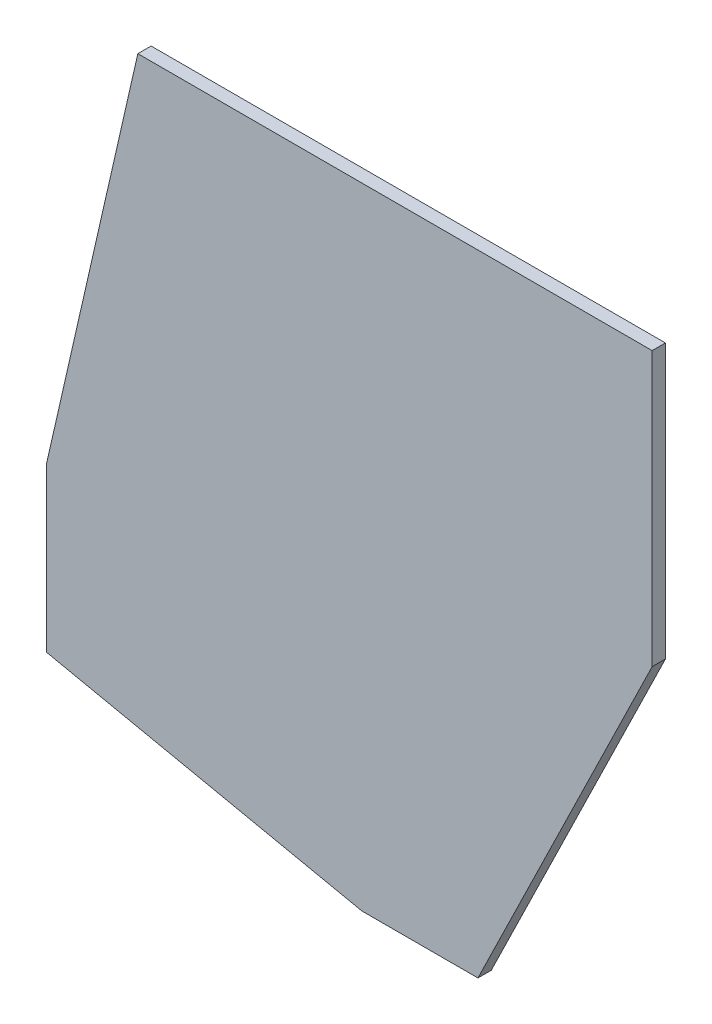
from build123d import *

# Parameters (mm, degrees)
SKETCH_1_R         = 13
EXTRUDE_1545_DEPTH = 16
EXTRUDE_1_DEPTH    = 16


with BuildPart() as part:
    # 草图1 → Extrude 1545 (new body)
    with BuildSketch(Plane.XY):
        Polygon((730, -330), (520, -760), (380, -760), (0, -680), (0, -482.786642105), (110, 0), (730, 0), align=None)
        with Locations((510, -70)):
            Circle(SKETCH_1_R, mode=Mode.SUBTRACT)
        with Locations((590, -70)):
            Circle(SKETCH_1_R, mode=Mode.SUBTRACT)
        with Locations((670, -70)):
            Circle(SKETCH_1_R, mode=Mode.SUBTRACT)
        with Locations((510, -150)):
            Circle(SKETCH_1_R, mode=Mode.SUBTRACT)
        with Locations((590, -150)):
            Circle(SKETCH_1_R, mode=Mode.SUBTRACT)
        with Locations((670, -150)):
            Circle(SKETCH_1_R, mode=Mode.SUBTRACT)
        with Locations((510, -230)):
            Circle(SKETCH_1_R, mode=Mode.SUBTRACT)
        with Locations((590, -230)):
            Circle(SKETCH_1_R, mode=Mode.SUBTRACT)
        with Locations((670, -230)):
            Circle(SKETCH_1_R, mode=Mode.SUBTRACT)
        with Locations(Location((230, -230, 0), (0, 0, 180))):
            Circle(SKETCH_1_R, mode=Mode.SUBTRACT)
        with Locations(Location((310, -230, 0), (0, 0, 180))):
            Circle(SKETCH_1_R, mode=Mode.SUBTRACT)
        with Locations(Location((390, -230, 0), (0, 0, 180))):
            Circle(SKETCH_1_R, mode=Mode.SUBTRACT)
        with Locations(Location((230, -150, 0), (0, 0, 180))):
            Circle(SKETCH_1_R, mode=Mode.SUBTRACT)
        with Locations(Location((310, -150, 0), (0, 0, 180))):
            Circle(SKETCH_1_R, mode=Mode.SUBTRACT)
        with Locations(Location((390, -150, 0), (0, 0, 180))):
            Circle(SKETCH_1_R, mode=Mode.SUBTRACT)
        with Locations(Location((230, -70, 0), (0, 0, 180))):
            Circle(SKETCH_1_R, mode=Mode.SUBTRACT)
        with Locations(Location((310, -70, 0), (0, 0, 180))):
            Circle(SKETCH_1_R, mode=Mode.SUBTRACT)
        with Locations(Location((390, -70, 0), (0, 0, 180))):
            Circle(SKETCH_1_R, mode=Mode.SUBTRACT)
        with Locations((150, -70)):
            Circle(SKETCH_1_R, mode=Mode.SUBTRACT)
        with Locations((150, -150)):
            Circle(SKETCH_1_R, mode=Mode.SUBTRACT)
        with Locations((150, -230)):
            Circle(SKETCH_1_R, mode=Mode.SUBTRACT)
        with Locations((590, -370)):
            Circle(SKETCH_1_R, mode=Mode.SUBTRACT)
        with Locations((510, -370)):
            Circle(SKETCH_1_R, mode=Mode.SUBTRACT)
        with Locations(Location((390, -370, 0), (0, 0, 180))):
            Circle(SKETCH_1_R, mode=Mode.SUBTRACT)
        with Locations(Location((310, -370, 0), (0, 0, 180))):
            Circle(SKETCH_1_R, mode=Mode.SUBTRACT)
        with Locations((506, -470)):
            Circle(SKETCH_1_R, mode=Mode.SUBTRACT)
        with Locations((506, -550)):
            Circle(SKETCH_1_R, mode=Mode.SUBTRACT)
        with Locations((506, -630)):
            Circle(SKETCH_1_R, mode=Mode.SUBTRACT)
        with Locations((506, -710)):
            Circle(SKETCH_1_R, mode=Mode.SUBTRACT)
        with Locations(Location((394, -710, 0), (0, 0, 180))):
            Circle(SKETCH_1_R, mode=Mode.SUBTRACT)
        with Locations(Location((394, -630, 0), (0, 0, 180))):
            Circle(SKETCH_1_R, mode=Mode.SUBTRACT)
        with Locations(Location((394, -550, 0), (0, 0, 180))):
            Circle(SKETCH_1_R, mode=Mode.SUBTRACT)
        with Locations(Location((394, -470, 0), (0, 0, 180))):
            Circle(SKETCH_1_R, mode=Mode.SUBTRACT)
        with Locations((149.479377198, -397.484050539)):
            Circle(SKETCH_1_R, mode=Mode.SUBTRACT)
        with Locations((99.493096694, -459.945012437)):
            Circle(SKETCH_1_R, mode=Mode.SUBTRACT)
        with Locations((49.506816189, -522.405974336)):
            Circle(SKETCH_1_R, mode=Mode.SUBTRACT)
        with Locations((61.981497584, -634.85321674)):
            Circle(SKETCH_1_R, mode=Mode.SUBTRACT)
        with Locations((111.967778088, -572.392254841)):
            Circle(SKETCH_1_R, mode=Mode.SUBTRACT)
        with Locations((161.954058593, -509.931292942)):
            Circle(SKETCH_1_R, mode=Mode.SUBTRACT)
        with Locations((211.940339097, -447.470331043)):
            Circle(SKETCH_1_R, mode=Mode.SUBTRACT)
        with Locations(Location((174.428739987, -622.378535345, 0), (0, 0, 180))):
            Circle(SKETCH_1_R, mode=Mode.SUBTRACT)
        with Locations(Location((224.415020492, -559.917573446, 0), (0, 0, 180))):
            Circle(SKETCH_1_R, mode=Mode.SUBTRACT)
        with Locations(Location((274.401300996, -497.456611548, 0), (0, 0, 180))):
            Circle(SKETCH_1_R, mode=Mode.SUBTRACT)
    extrude(amount=EXTRUDE_1545_DEPTH)

    # 草图2 → 凸台-拉伸1 (add)
    with BuildSketch(Plane.XY.offset(16)):
        Polygon((110, 0), (730, 0), (730, -330), (520, -760), (380, -760), (0, -680), (0, -482.786642105), align=None)
    extrude(amount=-EXTRUDE_1_DEPTH)


solid = part.part
